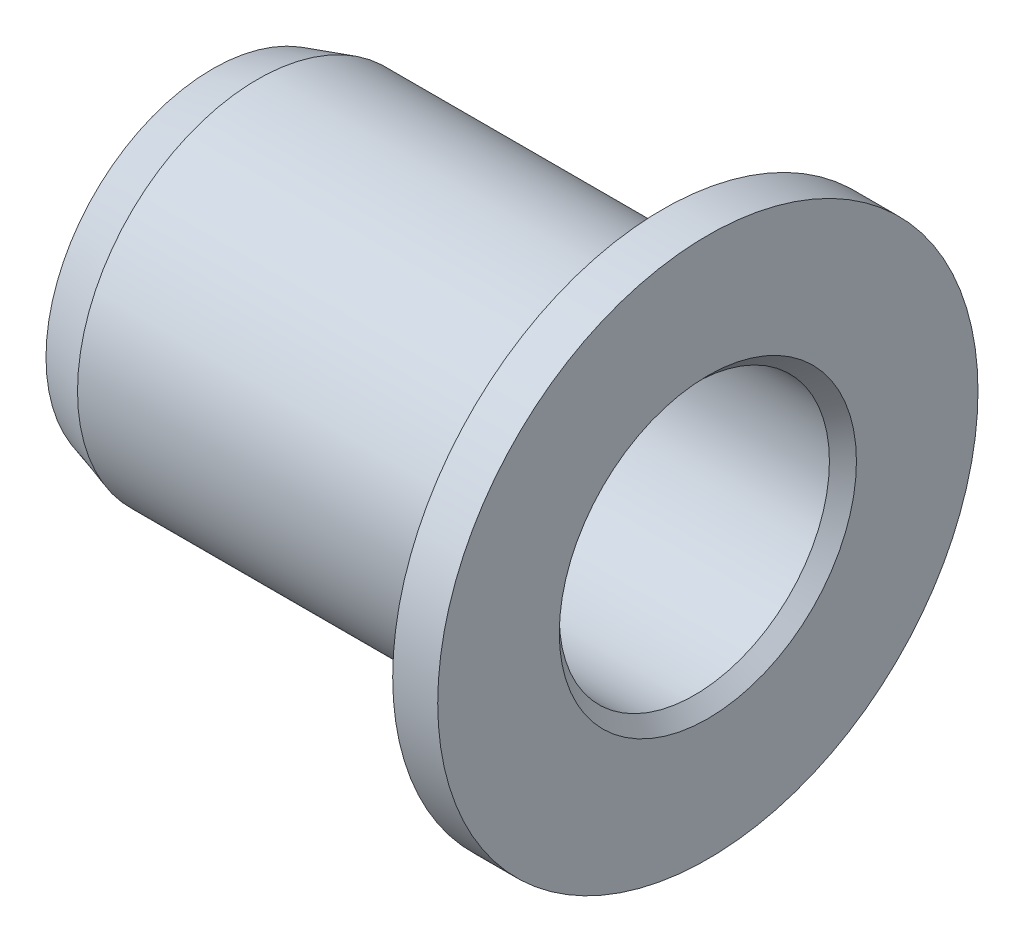
from build123d import *

# Parameters (mm, degrees)
CHAMFER_1_SIZE  = 0.3
CHAMFER_2_SIZE  = 1
CHAMFER_2_SIZE2 = 0.3


with BuildPart() as part:
    # ｽｹｯﾁ1 → 回転1 (revolve)
    with BuildSketch(Plane.XY, mode=Mode.PRIVATE) as revolve_1_sk:
        Polygon((0, 3), (0, 6), (-1, 6), (-1, 4), (-11, 4), (-11, 3), align=None)
    revolve(revolve_1_sk.sketch.rotate(Axis((0, 0, 0), (1, 0, 0)), 90), axis=Axis((0, 0, 0), (1, 0, 0)))

    # 面取り1
    chamfer_1_edges = [part.edges().sort_by_distance(p)[0] for p in [
        (0, 0, -3),
    ]]
    chamfer(chamfer_1_edges, length=CHAMFER_1_SIZE)

    # 面取り2
    chamfer_2_edges = [part.edges().sort_by_distance(p)[0] for p in [
        (-11, 0, -4),
    ]]
    chamfer_2_side = [part.faces().sort_by_distance(p)[0] for p in [
        (-6, 0, -4),
    ]]
    chamfer(chamfer_2_edges, length=CHAMFER_2_SIZE, length2=CHAMFER_2_SIZE2, reference=chamfer_2_side[0])


solid = part.part
